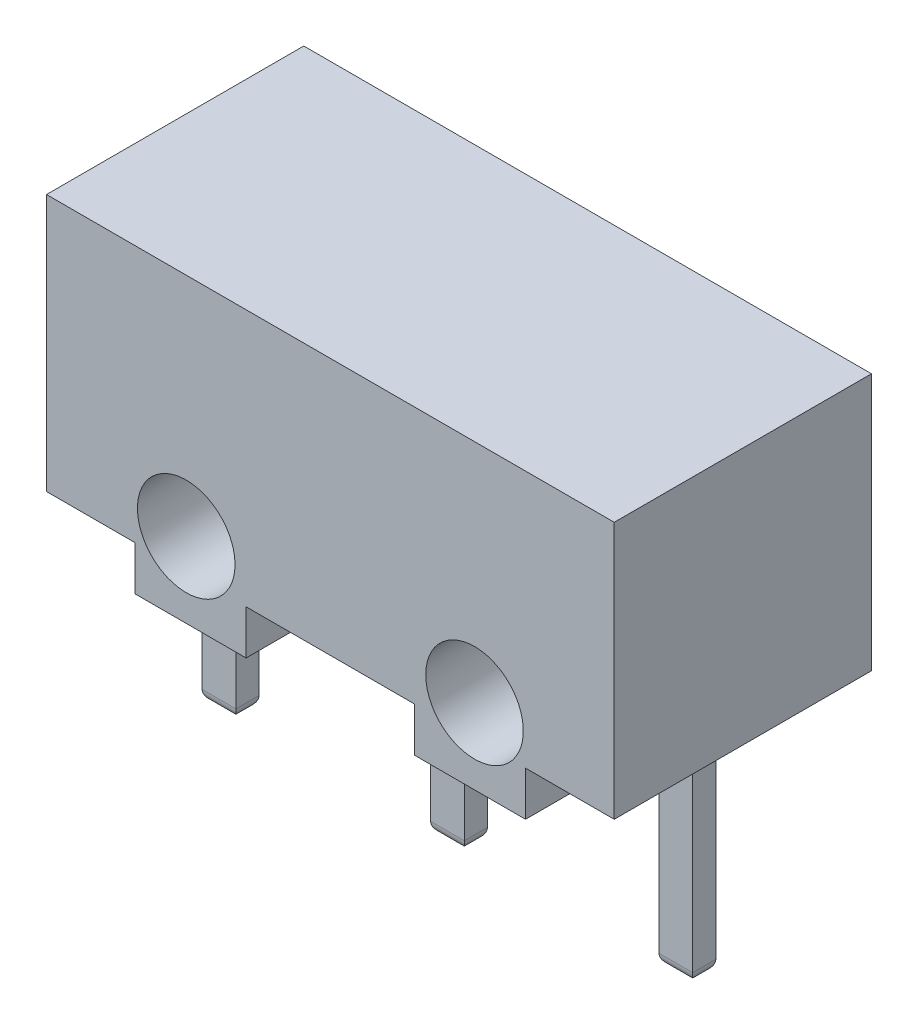
from build123d import *

# Parameters (mm, degrees)
SKETCH_1_W          = 12.8
SKETCH_1_H          = 5.8
EXTRUDE_1_DEPTH     = 5.8
SKETCH_2_W          = 0.76
SKETCH_2_H          = 0.52
EXTRUDE_2_DEPTH     = 5
FILLET_3_R          = 0.25
SKETCH_4_W          = 2.5
SKETCH_4_H          = 5.8
EXTRUDE_3_DEPTH     = 1
SKETCH_3_R          = 1.1
CUT_EXTRUDE_1_DEPTH = 11.403845443


with BuildPart() as part:
    # 草图1 → 凸台-拉伸1 (new body)
    with BuildSketch(Plane(origin=(0, 0, 0), x_dir=(1, 0, 0), z_dir=(0, 1, 0))):
        Rectangle(SKETCH_1_W, SKETCH_1_H)
    extrude(amount=EXTRUDE_1_DEPTH)

    # 草图2 → 凸台-拉伸2 (add)
    with BuildSketch(Plane.XZ):
        Rectangle(SKETCH_2_W, SKETCH_2_H)
        with Locations((5.15, 0)):
            Rectangle(SKETCH_2_W, SKETCH_2_H)
        with Locations((-5.15, 0)):
            Rectangle(SKETCH_2_W, SKETCH_2_H)
    extrude(amount=EXTRUDE_2_DEPTH)

    # 圆角3
    fillet_3_edges = [part.edges().sort_by_distance(p)[0] for p in [
        (0.38, -5, 0),
        (0, -5, 0.26),
        (-0.38, -5, 0),
        (0, -5, -0.26),
        (5.15, -5, 0.26),
        (4.77, -5, 0),
        (5.15, -5, -0.26),
        (5.53, -5, 0),
        (-4.77, -5, 0),
        (-5.15, -5, 0.26),
        (-5.53, -5, 0),
        (-5.15, -5, -0.26),
    ]]
    fillet(fillet_3_edges, radius=FILLET_3_R)

    # 草图4 → 凸台-拉伸3 (add)
    with BuildSketch(Plane.XZ):
        with Locations((-3.15, 0)):
            Rectangle(SKETCH_4_W, SKETCH_4_H)
        with Locations((3.15, 0)):
            Rectangle(SKETCH_4_W, SKETCH_4_H)
    extrude(amount=EXTRUDE_3_DEPTH)

    # 草图3 → 切除-拉伸1 (cut, through all)
    with BuildSketch(Plane.XY.offset(2.9)):
        with Locations((-3.25, 0.7)):
            Circle(SKETCH_3_R)
        with Locations(Location((3.25, 0.7, 0), (0, 0, 180))):
            Circle(SKETCH_3_R)
    extrude(amount=-CUT_EXTRUDE_1_DEPTH, mode=Mode.SUBTRACT)


solid = part.part
